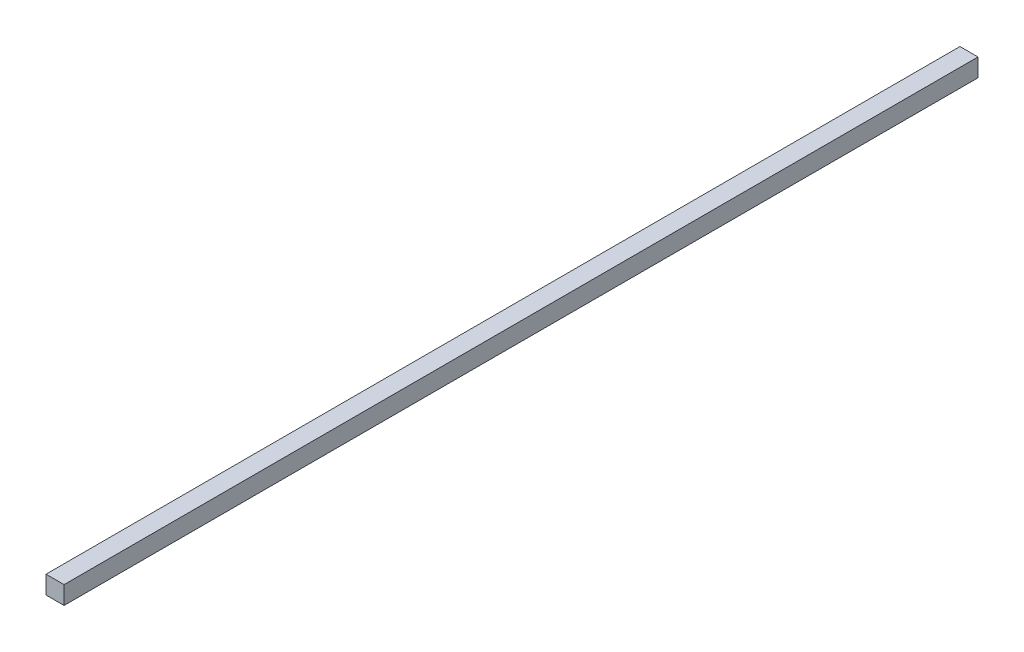
from build123d import *

# Parameters (mm, degrees)
SKETCH1_W           = 6.35
SKETCH1_H           = 6.35
BOSS_EXTRUDE1_DEPTH = 321.31


with BuildPart() as part:
    # Sketch1 → Boss-Extrude1 (new body)
    with BuildSketch(Plane.XY):
        Rectangle(SKETCH1_W, SKETCH1_H)
    extrude(amount=BOSS_EXTRUDE1_DEPTH)


solid = part.part
